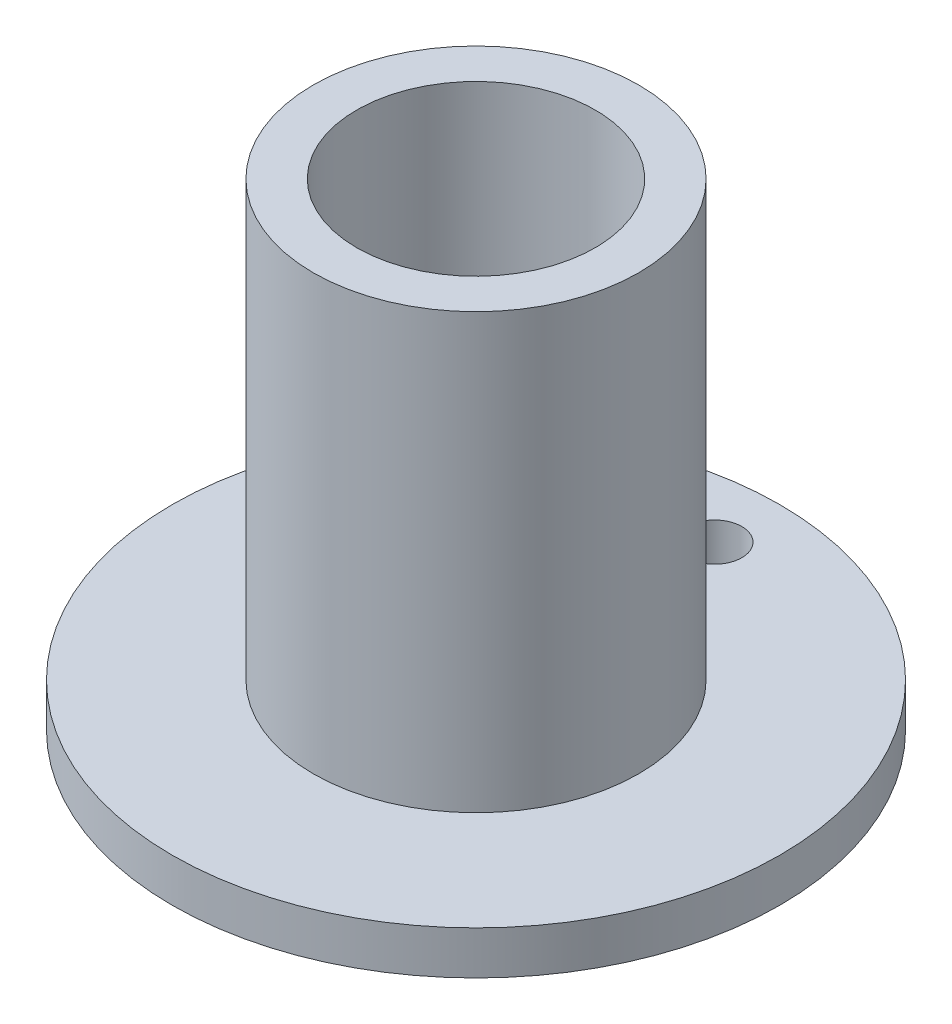
from build123d import *

# Parameters (mm, degrees)
SKETCH1_R           = 14
SKETCH1_R_2         = 5.5
BOSS_EXTRUDE1_DEPTH = 2
SKETCH2_R           = 1.25
CUT_EXTRUDE1_DEPTH  = 2
SKETCH3_R           = 7.5
SKETCH3_R_2         = 5.5
BOSS_EXTRUDE2_DEPTH = 20


with BuildPart() as part:
    # Sketch1 → Boss-Extrude1 (new body)
    with BuildSketch(Plane(origin=(0, 0, 0), x_dir=(1, 0, 0), z_dir=(0, 1, 0))):
        with Locations(Location((0, 0, 0), (0, 0, 270))):
            Circle(SKETCH1_R)
        with Locations(Location((0, 0, 0), (0, 0, 270))):
            Circle(SKETCH1_R_2, mode=Mode.SUBTRACT)
    extrude(amount=BOSS_EXTRUDE1_DEPTH)

    # Sketch2 → Cut-Extrude1 (cut)
    with BuildSketch(Plane(origin=(0, 2, 0), x_dir=(1, 0, 0), z_dir=(0, 1, 0))):
        with Locations(Location((0, 11, 0), (0, 0, 270))):
            Circle(SKETCH2_R)
    extrude(amount=-CUT_EXTRUDE1_DEPTH, mode=Mode.SUBTRACT)

    # Sketch3 → Boss-Extrude2 (add)
    with BuildSketch(Plane(origin=(0, 2, 0), x_dir=(1, 0, 0), z_dir=(0, 1, 0))):
        with Locations(Location((0, 0, 0), (0, 0, 270))):
            Circle(SKETCH3_R)
        with Locations(Location((0, 0, 0), (0, 0, 270))):
            Circle(SKETCH3_R_2, mode=Mode.SUBTRACT)
    extrude(amount=BOSS_EXTRUDE2_DEPTH)


solid = part.part
